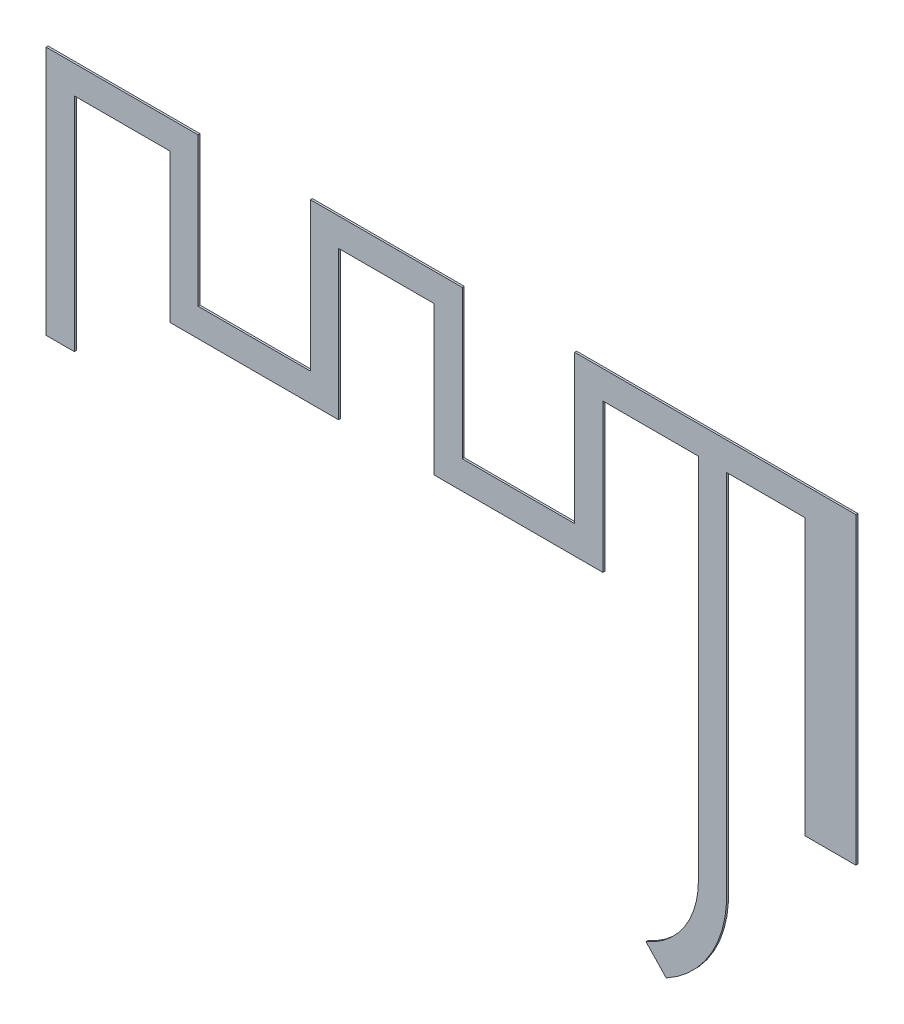
from build123d import *

# Parameters (mm, degrees)
BOSS_EXTRUDE1_DEPTH = 0.035


with BuildPart() as part:
    # Sketch2 → Boss-Extrude1 (new body)
    with BuildSketch(Plane.XY):
        with BuildLine():
            Line((177.15, -43.365), (177.15, -38.715))
            Line((177.15, -38.715), (178.55, -38.715))
            Line((178.55, -38.715), (178.55, -43.615))
            Line((178.55, -43.615), (179.45, -43.615))
            Line((179.45, -43.615), (179.45, -38.215))
            Line((179.45, -38.215), (174.45, -38.215))
            Line((174.45, -38.215), (174.45, -40.855))
            Line((174.45, -40.855), (172.45, -40.855))
            Line((172.45, -40.855), (172.45, -38.215))
            Line((172.45, -38.215), (169.75, -38.215))
            Line((169.75, -38.215), (169.75, -40.855))
            Line((169.75, -40.855), (167.75, -40.855))
            Line((167.75, -40.855), (167.75, -38.215))
            Line((167.75, -38.215), (165.05, -38.215))
            Line((165.05, -38.215), (165.05, -42.655))
            Line((165.05, -42.655), (165.55, -42.655))
            Line((165.55, -42.655), (165.55, -38.715))
            Line((165.55, -38.715), (167.25, -38.715))
            Line((167.25, -38.715), (167.25, -41.355))
            Line((167.25, -41.355), (170.25, -41.355))
            Line((170.25, -41.355), (170.25, -38.715))
            Line((170.25, -38.715), (171.95, -38.715))
            Line((171.95, -38.715), (171.95, -41.355))
            Line((171.95, -41.355), (174.95, -41.355))
            Line((174.95, -41.355), (174.95, -38.715))
            Line((174.95, -38.715), (176.65, -38.715))
            Line((176.65, -38.715), (176.65, -43.494121754))
            Line((176.65, -43.494121754), (176.65, -45.231483))
            ThreePointArc((176.65, -45.231483), (176.401357883, -46.087735796), (175.716135, -46.658228))
            Line((175.716135, -46.658228), (176.077028, -47.038824))
            ThreePointArc((176.077028, -47.038824), (176.835321007, -46.327629006), (177.15, -45.336779))
            Line((177.15, -45.336779), (177.15, -43.365))
        make_face()
    extrude(amount=BOSS_EXTRUDE1_DEPTH)


solid = part.part
